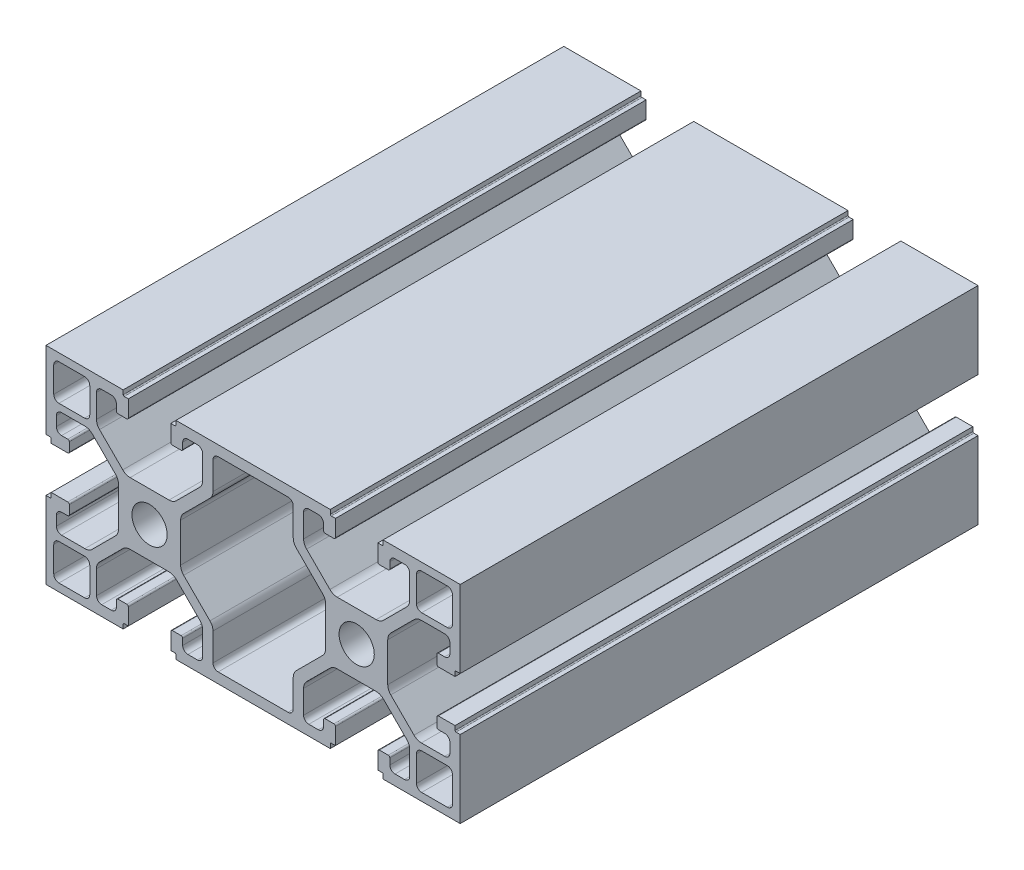
from build123d import *

# Parameters (mm, degrees)
SKETCH_1_R      = 3.4
EXTRUDE_1_DEPTH = 100


with BuildPart() as part:
    # 草图1 → 凸台-拉伸1 (new body)
    with BuildSketch(Plane.XY):
        with BuildLine():
            Line((-24.371587854, 18.940182328), (-39.271587854, 18.940182328))
            Line((-39.271587854, 18.940182328), (-39.271587854, 4.040182328))
            Line((-39.271587854, 4.040182328), (-38.471587854, 4.040182328))
            ThreePointArc((-38.471587854, 4.040182328), (-38.330166498, 3.981603684), (-38.271587854, 3.840182328))
            Line((-38.271587854, 3.840182328), (-38.271587854, 3.040182328))
            Line((-38.271587854, 3.040182328), (-35.071587854, 3.040182328))
            ThreePointArc((-35.071587854, 3.040182328), (-34.85945582, 3.128050294), (-34.771587854, 3.340182328))
            Line((-34.771587854, 3.340182328), (-34.771587854, 5.040182328))
            ThreePointArc((-34.771587854, 5.040182328), (-34.85945582, 5.252314363), (-35.071587854, 5.340182328))
            Line((-35.071587854, 5.340182328), (-36.271587854, 5.340182328))
            ThreePointArc((-36.271587854, 5.340182328), (-36.978694635, 5.633075547), (-37.271587854, 6.340182328))
            Line((-37.271587854, 6.340182328), (-37.271587854, 8.190182328))
            ThreePointArc((-37.271587854, 8.190182328), (-36.978694635, 8.897289109), (-36.271587854, 9.190182328))
            Line((-36.271587854, 9.190182328), (-31.764228541, 9.190182328))
            ThreePointArc((-31.764228541, 9.190182328), (-30.998861677, 9.037941393), (-30.350014979, 8.604395891))
            Line((-30.350014979, 8.604395891), (-25.857374292, 4.111755203))
            ThreePointArc((-25.857374292, 4.111755203), (-25.423828789, 3.462908506), (-25.271587854, 2.697541641))
            Line((-25.271587854, 2.697541641), (-25.271587854, -4.817176985))
            ThreePointArc((-25.271587854, -4.817176985), (-25.423828789, -5.582543849), (-25.857374292, -6.231390547))
            Line((-25.857374292, -6.231390547), (-30.350014979, -10.724031234))
            ThreePointArc((-30.350014979, -10.724031234), (-30.998861677, -11.157576737), (-31.764228541, -11.309817672))
            Line((-31.764228541, -11.309817672), (-36.271587854, -11.309817672))
            ThreePointArc((-36.271587854, -11.309817672), (-36.978694635, -11.016924453), (-37.271587854, -10.309817672))
            Line((-37.271587854, -10.309817672), (-37.271587854, -8.459817672))
            ThreePointArc((-37.271587854, -8.459817672), (-36.978694635, -7.752710891), (-36.271587854, -7.459817672))
            Line((-36.271587854, -7.459817672), (-35.071587854, -7.459817672))
            ThreePointArc((-35.071587854, -7.459817672), (-34.85945582, -7.371949706), (-34.771587854, -7.159817672))
            Line((-34.771587854, -7.159817672), (-34.771587854, -5.459817672))
            ThreePointArc((-34.771587854, -5.459817672), (-34.85945582, -5.247685637), (-35.071587854, -5.159817672))
            Line((-35.071587854, -5.159817672), (-38.271587854, -5.159817672))
            Line((-38.271587854, -5.159817672), (-38.271587854, -5.959817672))
            ThreePointArc((-38.271587854, -5.959817672), (-38.330166498, -6.101239028), (-38.471587854, -6.159817672))
            Line((-38.471587854, -6.159817672), (-39.271587854, -6.159817672))
            Line((-39.271587854, -6.159817672), (-39.271587854, -21.059817672))
            Line((-39.271587854, -21.059817672), (-24.371587854, -21.059817672))
            Line((-24.371587854, -21.059817672), (-24.371587854, -20.259817672))
            ThreePointArc((-24.371587854, -20.259817672), (-24.31300921, -20.118396316), (-24.171587854, -20.059817672))
            Line((-24.171587854, -20.059817672), (-23.371587854, -20.059817672))
            Line((-23.371587854, -20.059817672), (-23.371587854, -16.859817672))
            ThreePointArc((-23.371587854, -16.859817672), (-23.45945582, -16.647685637), (-23.671587854, -16.559817672))
            Line((-23.671587854, -16.559817672), (-25.371587854, -16.559817672))
            ThreePointArc((-25.371587854, -16.559817672), (-25.583719889, -16.647685637), (-25.671587854, -16.859817672))
            Line((-25.671587854, -16.859817672), (-25.671587854, -18.059817672))
            ThreePointArc((-25.671587854, -18.059817672), (-25.964481073, -18.766924453), (-26.671587854, -19.059817672))
            Line((-26.671587854, -19.059817672), (-28.521587854, -19.059817672))
            ThreePointArc((-28.521587854, -19.059817672), (-29.228694635, -18.766924453), (-29.521587854, -18.059817672))
            Line((-29.521587854, -18.059817672), (-29.521587854, -13.552458359))
            ThreePointArc((-29.521587854, -13.552458359), (-29.369346919, -12.787091494), (-28.935801417, -12.138244797))
            Line((-28.935801417, -12.138244797), (-24.443160729, -7.645604109))
            ThreePointArc((-24.443160729, -7.645604109), (-23.794314032, -7.212058607), (-23.028947167, -7.059817672))
            Line((-23.028947167, -7.059817672), (-15.514228541, -7.059817672))
            ThreePointArc((-15.514228541, -7.059817672), (-14.748861677, -7.212058607), (-14.100014979, -7.645604109))
            Line((-14.100014979, -7.645604109), (-9.607374292, -12.138244797))
            ThreePointArc((-9.607374292, -12.138244797), (-9.173828789, -12.787091494), (-9.021587854, -13.552458359))
            Line((-9.021587854, -13.552458359), (-9.021587854, -18.059817672))
            ThreePointArc((-9.021587854, -18.059817672), (-9.314481073, -18.766924453), (-10.021587854, -19.059817672))
            Line((-10.021587854, -19.059817672), (-11.871587854, -19.059817672))
            ThreePointArc((-11.871587854, -19.059817672), (-12.578694635, -18.766924453), (-12.871587854, -18.059817672))
            Line((-12.871587854, -18.059817672), (-12.871587854, -16.859817672))
            ThreePointArc((-12.871587854, -16.859817672), (-12.95945582, -16.647685637), (-13.171587854, -16.559817672))
            Line((-13.171587854, -16.559817672), (-14.871587854, -16.559817672))
            ThreePointArc((-14.871587854, -16.559817672), (-15.083719889, -16.647685637), (-15.171587854, -16.859817672))
            Line((-15.171587854, -16.859817672), (-15.171587854, -20.059817672))
            Line((-15.171587854, -20.059817672), (-14.371587854, -20.059817672))
            ThreePointArc((-14.371587854, -20.059817672), (-14.230166498, -20.118396316), (-14.171587854, -20.259817672))
            Line((-14.171587854, -20.259817672), (-14.171587854, -21.059817672))
            Line((-14.171587854, -21.059817672), (0.728412146, -21.059817672))
            Line((0.728412146, -21.059817672), (15.628412146, -21.059817672))
            Line((15.628412146, -21.059817672), (15.628412146, -20.259817672))
            ThreePointArc((15.628412146, -20.259817672), (15.68699079, -20.118396316), (15.828412146, -20.059817672))
            Line((15.828412146, -20.059817672), (16.628412146, -20.059817672))
            Line((16.628412146, -20.059817672), (16.628412146, -16.859817672))
            ThreePointArc((16.628412146, -16.859817672), (16.54054418, -16.647685637), (16.328412146, -16.559817672))
            Line((16.328412146, -16.559817672), (14.628412146, -16.559817672))
            ThreePointArc((14.628412146, -16.559817672), (14.416280111, -16.647685637), (14.328412146, -16.859817672))
            Line((14.328412146, -16.859817672), (14.328412146, -18.059817672))
            ThreePointArc((14.328412146, -18.059817672), (14.035518927, -18.766924453), (13.328412146, -19.059817672))
            Line((13.328412146, -19.059817672), (11.478412146, -19.059817672))
            ThreePointArc((11.478412146, -19.059817672), (10.771305365, -18.766924453), (10.478412146, -18.059817672))
            Line((10.478412146, -18.059817672), (10.478412146, -13.552458359))
            ThreePointArc((10.478412146, -13.552458359), (10.630653081, -12.787091494), (11.064198583, -12.138244797))
            Line((11.064198583, -12.138244797), (15.556839271, -7.645604109))
            ThreePointArc((15.556839271, -7.645604109), (16.205685968, -7.212058607), (16.971052833, -7.059817672))
            Line((16.971052833, -7.059817672), (24.485771459, -7.059817672))
            ThreePointArc((24.485771459, -7.059817672), (25.251138323, -7.212058607), (25.899985021, -7.645604109))
            Line((25.899985021, -7.645604109), (30.392625708, -12.138244797))
            ThreePointArc((30.392625708, -12.138244797), (30.826171211, -12.787091494), (30.978412146, -13.552458359))
            Line((30.978412146, -13.552458359), (30.978412146, -18.059817672))
            ThreePointArc((30.978412146, -18.059817672), (30.685518927, -18.766924453), (29.978412146, -19.059817672))
            Line((29.978412146, -19.059817672), (28.128412146, -19.059817672))
            ThreePointArc((28.128412146, -19.059817672), (27.421305365, -18.766924453), (27.128412146, -18.059817672))
            Line((27.128412146, -18.059817672), (27.128412146, -16.859817672))
            ThreePointArc((27.128412146, -16.859817672), (27.04054418, -16.647685637), (26.828412146, -16.559817672))
            Line((26.828412146, -16.559817672), (25.128412146, -16.559817672))
            ThreePointArc((25.128412146, -16.559817672), (24.916280111, -16.647685637), (24.828412146, -16.859817672))
            Line((24.828412146, -16.859817672), (24.828412146, -20.059817672))
            Line((24.828412146, -20.059817672), (25.628412146, -20.059817672))
            ThreePointArc((25.628412146, -20.059817672), (25.769833502, -20.118396316), (25.828412146, -20.259817672))
            Line((25.828412146, -20.259817672), (25.828412146, -21.059817672))
            Line((25.828412146, -21.059817672), (40.728412146, -21.059817672))
            Line((40.728412146, -21.059817672), (40.728412146, -6.159817672))
            Line((40.728412146, -6.159817672), (39.928412146, -6.159817672))
            ThreePointArc((39.928412146, -6.159817672), (39.78699079, -6.101239028), (39.728412146, -5.959817672))
            Line((39.728412146, -5.959817672), (39.728412146, -5.159817672))
            Line((39.728412146, -5.159817672), (36.528412146, -5.159817672))
            ThreePointArc((36.528412146, -5.159817672), (36.316280111, -5.247685637), (36.228412146, -5.459817672))
            Line((36.228412146, -5.459817672), (36.228412146, -7.159817672))
            ThreePointArc((36.228412146, -7.159817672), (36.316280111, -7.371949706), (36.528412146, -7.459817672))
            Line((36.528412146, -7.459817672), (37.728412146, -7.459817672))
            ThreePointArc((37.728412146, -7.459817672), (38.435518927, -7.752710891), (38.728412146, -8.459817672))
            Line((38.728412146, -8.459817672), (38.728412146, -10.309817672))
            ThreePointArc((38.728412146, -10.309817672), (38.435518927, -11.016924453), (37.728412146, -11.309817672))
            Line((37.728412146, -11.309817672), (33.221052833, -11.309817672))
            ThreePointArc((33.221052833, -11.309817672), (32.455685968, -11.157576737), (31.806839271, -10.724031234))
            Line((31.806839271, -10.724031234), (27.314198583, -6.231390547))
            ThreePointArc((27.314198583, -6.231390547), (26.880653081, -5.582543849), (26.728412146, -4.817176985))
            Line((26.728412146, -4.817176985), (26.728412146, 2.697541641))
            ThreePointArc((26.728412146, 2.697541641), (26.880653081, 3.462908506), (27.314198583, 4.111755203))
            Line((27.314198583, 4.111755203), (31.806839271, 8.604395891))
            ThreePointArc((31.806839271, 8.604395891), (32.455685968, 9.037941393), (33.221052833, 9.190182328))
            Line((33.221052833, 9.190182328), (37.728412146, 9.190182328))
            ThreePointArc((37.728412146, 9.190182328), (38.435518927, 8.897289109), (38.728412146, 8.190182328))
            Line((38.728412146, 8.190182328), (38.728412146, 6.340182328))
            ThreePointArc((38.728412146, 6.340182328), (38.435518927, 5.633075547), (37.728412146, 5.340182328))
            Line((37.728412146, 5.340182328), (36.528412146, 5.340182328))
            ThreePointArc((36.528412146, 5.340182328), (36.316280111, 5.252314363), (36.228412146, 5.040182328))
            Line((36.228412146, 5.040182328), (36.228412146, 3.340182328))
            ThreePointArc((36.228412146, 3.340182328), (36.316280111, 3.128050294), (36.528412146, 3.040182328))
            Line((36.528412146, 3.040182328), (39.728412146, 3.040182328))
            Line((39.728412146, 3.040182328), (39.728412146, 3.840182328))
            ThreePointArc((39.728412146, 3.840182328), (39.78699079, 3.981603684), (39.928412146, 4.040182328))
            Line((39.928412146, 4.040182328), (40.728412146, 4.040182328))
            Line((40.728412146, 4.040182328), (40.728412146, 18.940182328))
            Line((40.728412146, 18.940182328), (25.828412146, 18.940182328))
            Line((25.828412146, 18.940182328), (25.828412146, 18.140182328))
            ThreePointArc((25.828412146, 18.140182328), (25.769833502, 17.998760972), (25.628412146, 17.940182328))
            Line((25.628412146, 17.940182328), (24.828412146, 17.940182328))
            Line((24.828412146, 17.940182328), (24.828412146, 14.740182328))
            ThreePointArc((24.828412146, 14.740182328), (24.916280111, 14.528050294), (25.128412146, 14.440182328))
            Line((25.128412146, 14.440182328), (26.828412146, 14.440182328))
            ThreePointArc((26.828412146, 14.440182328), (27.04054418, 14.528050294), (27.128412146, 14.740182328))
            Line((27.128412146, 14.740182328), (27.128412146, 15.940182328))
            ThreePointArc((27.128412146, 15.940182328), (27.421305365, 16.647289109), (28.128412146, 16.940182328))
            Line((28.128412146, 16.940182328), (29.978412146, 16.940182328))
            ThreePointArc((29.978412146, 16.940182328), (30.685518927, 16.647289109), (30.978412146, 15.940182328))
            Line((30.978412146, 15.940182328), (30.978412146, 11.432823015))
            ThreePointArc((30.978412146, 11.432823015), (30.826171211, 10.667456151), (30.392625708, 10.018609453))
            Line((30.392625708, 10.018609453), (25.899985021, 5.525968766))
            ThreePointArc((25.899985021, 5.525968766), (25.251138323, 5.092423263), (24.485771459, 4.940182328))
            Line((24.485771459, 4.940182328), (16.971052833, 4.940182328))
            ThreePointArc((16.971052833, 4.940182328), (16.205685968, 5.092423263), (15.556839271, 5.525968766))
            Line((15.556839271, 5.525968766), (11.064198583, 10.018609453))
            ThreePointArc((11.064198583, 10.018609453), (10.630653081, 10.667456151), (10.478412146, 11.432823015))
            Line((10.478412146, 11.432823015), (10.478412146, 15.940182328))
            ThreePointArc((10.478412146, 15.940182328), (10.771305365, 16.647289109), (11.478412146, 16.940182328))
            Line((11.478412146, 16.940182328), (13.328412146, 16.940182328))
            ThreePointArc((13.328412146, 16.940182328), (14.035518927, 16.647289109), (14.328412146, 15.940182328))
            Line((14.328412146, 15.940182328), (14.328412146, 14.740182328))
            ThreePointArc((14.328412146, 14.740182328), (14.416280111, 14.528050294), (14.628412146, 14.440182328))
            Line((14.628412146, 14.440182328), (16.328412146, 14.440182328))
            ThreePointArc((16.328412146, 14.440182328), (16.54054418, 14.528050294), (16.628412146, 14.740182328))
            Line((16.628412146, 14.740182328), (16.628412146, 17.940182328))
            Line((16.628412146, 17.940182328), (15.828412146, 17.940182328))
            ThreePointArc((15.828412146, 17.940182328), (15.68699079, 17.998760972), (15.628412146, 18.140182328))
            Line((15.628412146, 18.140182328), (15.628412146, 18.940182328))
            Line((15.628412146, 18.940182328), (0.728412146, 18.940182328))
            Line((0.728412146, 18.940182328), (-14.171587854, 18.940182328))
            Line((-14.171587854, 18.940182328), (-14.171587854, 18.140182328))
            ThreePointArc((-14.171587854, 18.140182328), (-14.230166498, 17.998760972), (-14.371587854, 17.940182328))
            Line((-14.371587854, 17.940182328), (-15.171587854, 17.940182328))
            Line((-15.171587854, 17.940182328), (-15.171587854, 14.740182328))
            ThreePointArc((-15.171587854, 14.740182328), (-15.083719889, 14.528050294), (-14.871587854, 14.440182328))
            Line((-14.871587854, 14.440182328), (-13.171587854, 14.440182328))
            ThreePointArc((-13.171587854, 14.440182328), (-12.95945582, 14.528050294), (-12.871587854, 14.740182328))
            Line((-12.871587854, 14.740182328), (-12.871587854, 15.940182328))
            ThreePointArc((-12.871587854, 15.940182328), (-12.578694635, 16.647289109), (-11.871587854, 16.940182328))
            Line((-11.871587854, 16.940182328), (-10.021587854, 16.940182328))
            ThreePointArc((-10.021587854, 16.940182328), (-9.314481073, 16.647289109), (-9.021587854, 15.940182328))
            Line((-9.021587854, 15.940182328), (-9.021587854, 11.432823015))
            ThreePointArc((-9.021587854, 11.432823015), (-9.173828789, 10.667456151), (-9.607374292, 10.018609453))
            Line((-9.607374292, 10.018609453), (-14.100014979, 5.525968766))
            ThreePointArc((-14.100014979, 5.525968766), (-14.748861677, 5.092423263), (-15.514228541, 4.940182328))
            Line((-15.514228541, 4.940182328), (-23.028947167, 4.940182328))
            ThreePointArc((-23.028947167, 4.940182328), (-23.794314032, 5.092423263), (-24.443160729, 5.525968766))
            Line((-24.443160729, 5.525968766), (-28.935801417, 10.018609453))
            ThreePointArc((-28.935801417, 10.018609453), (-29.369346919, 10.667456151), (-29.521587854, 11.432823015))
            Line((-29.521587854, 11.432823015), (-29.521587854, 15.940182328))
            ThreePointArc((-29.521587854, 15.940182328), (-29.228694635, 16.647289109), (-28.521587854, 16.940182328))
            Line((-28.521587854, 16.940182328), (-26.671587854, 16.940182328))
            ThreePointArc((-26.671587854, 16.940182328), (-25.964481073, 16.647289109), (-25.671587854, 15.940182328))
            Line((-25.671587854, 15.940182328), (-25.671587854, 14.740182328))
            ThreePointArc((-25.671587854, 14.740182328), (-25.583719889, 14.528050294), (-25.371587854, 14.440182328))
            Line((-25.371587854, 14.440182328), (-23.671587854, 14.440182328))
            ThreePointArc((-23.671587854, 14.440182328), (-23.45945582, 14.528050294), (-23.371587854, 14.740182328))
            Line((-23.371587854, 14.740182328), (-23.371587854, 17.940182328))
            Line((-23.371587854, 17.940182328), (-24.171587854, 17.940182328))
            ThreePointArc((-24.171587854, 17.940182328), (-24.31300921, 17.998760972), (-24.371587854, 18.140182328))
            Line((-24.371587854, 18.140182328), (-24.371587854, 18.940182328))
        make_face()
        with Locations((-19.271587854, -1.059817672)):
            Circle(SKETCH_1_R, mode=Mode.SUBTRACT)
        with Locations((20.728412146, -1.059817672)):
            Circle(SKETCH_1_R, mode=Mode.SUBTRACT)
        with BuildLine():
            Line((-13.271587854, 2.697541641), (-13.271587854, -4.817176985))
            ThreePointArc((-13.271587854, -4.817176985), (-13.119346919, -5.582543849), (-12.685801417, -6.231390547))
            Line((-12.685801417, -6.231390547), (-7.607374292, -11.309817672))
            ThreePointArc((-7.607374292, -11.309817672), (-7.173828789, -11.958664369), (-7.021587854, -12.724031234))
            Line((-7.021587854, -12.724031234), (-7.021587854, -18.059817672))
            ThreePointArc((-7.021587854, -18.059817672), (-6.728694635, -18.766924453), (-6.021587854, -19.059817672))
            Line((-6.021587854, -19.059817672), (7.478412146, -19.059817672))
            ThreePointArc((7.478412146, -19.059817672), (8.185518927, -18.766924453), (8.478412146, -18.059817672))
            Line((8.478412146, -18.059817672), (8.478412146, -12.724031234))
            ThreePointArc((8.478412146, -12.724031234), (8.630653081, -11.958664369), (9.064198583, -11.309817672))
            Line((9.064198583, -11.309817672), (14.142625708, -6.231390547))
            ThreePointArc((14.142625708, -6.231390547), (14.576171211, -5.582543849), (14.728412146, -4.817176985))
            Line((14.728412146, -4.817176985), (14.728412146, 2.697541641))
            ThreePointArc((14.728412146, 2.697541641), (14.576171211, 3.462908506), (14.142625708, 4.111755203))
            Line((14.142625708, 4.111755203), (9.064198583, 9.190182328))
            ThreePointArc((9.064198583, 9.190182328), (8.630653081, 9.839029026), (8.478412146, 10.604395891))
            Line((8.478412146, 10.604395891), (8.478412146, 15.940182328))
            ThreePointArc((8.478412146, 15.940182328), (8.185518927, 16.647289109), (7.478412146, 16.940182328))
            Line((7.478412146, 16.940182328), (-6.021587854, 16.940182328))
            ThreePointArc((-6.021587854, 16.940182328), (-6.728694635, 16.647289109), (-7.021587854, 15.940182328))
            Line((-7.021587854, 15.940182328), (-7.021587854, 10.604395891))
            ThreePointArc((-7.021587854, 10.604395891), (-7.173828789, 9.839029026), (-7.607374292, 9.190182328))
            Line((-7.607374292, 9.190182328), (-12.685801417, 4.111755203))
            ThreePointArc((-12.685801417, 4.111755203), (-13.119346919, 3.462908506), (-13.271587854, 2.697541641))
        make_face(mode=Mode.SUBTRACT)
        with BuildLine():
            Line((38.232412146, 17.444182328), (33.278412146, 17.444182328))
            ThreePointArc((33.278412146, 17.444182328), (32.571305365, 17.151289109), (32.278412146, 16.444182328))
            Line((32.278412146, 16.444182328), (32.278412146, 11.490182328))
            ThreePointArc((32.278412146, 11.490182328), (32.571305365, 10.783075547), (33.278412146, 10.490182328))
            Line((33.278412146, 10.490182328), (38.232412146, 10.490182328))
            ThreePointArc((38.232412146, 10.490182328), (38.939518927, 10.783075547), (39.232412146, 11.490182328))
            Line((39.232412146, 11.490182328), (39.232412146, 16.444182328))
            ThreePointArc((39.232412146, 16.444182328), (38.939518927, 17.151289109), (38.232412146, 17.444182328))
        make_face(mode=Mode.SUBTRACT)
        with BuildLine():
            Line((-36.775587854, 10.490182328), (-31.821587854, 10.490182328))
            ThreePointArc((-31.821587854, 10.490182328), (-31.114481073, 10.783075547), (-30.821587854, 11.490182328))
            Line((-30.821587854, 11.490182328), (-30.821587854, 16.444182328))
            ThreePointArc((-30.821587854, 16.444182328), (-31.114481073, 17.151289109), (-31.821587854, 17.444182328))
            Line((-31.821587854, 17.444182328), (-36.775587854, 17.444182328))
            ThreePointArc((-36.775587854, 17.444182328), (-37.482694635, 17.151289109), (-37.775587854, 16.444182328))
            Line((-37.775587854, 16.444182328), (-37.775587854, 11.490182328))
            ThreePointArc((-37.775587854, 11.490182328), (-37.482694635, 10.783075547), (-36.775587854, 10.490182328))
        make_face(mode=Mode.SUBTRACT)
        with BuildLine():
            Line((38.232412146, -19.563817672), (33.278412146, -19.563817672))
            ThreePointArc((33.278412146, -19.563817672), (32.571305365, -19.270924453), (32.278412146, -18.563817672))
            Line((32.278412146, -18.563817672), (32.278412146, -13.609817672))
            ThreePointArc((32.278412146, -13.609817672), (32.571305365, -12.902710891), (33.278412146, -12.609817672))
            Line((33.278412146, -12.609817672), (38.232412146, -12.609817672))
            ThreePointArc((38.232412146, -12.609817672), (38.939518927, -12.902710891), (39.232412146, -13.609817672))
            Line((39.232412146, -13.609817672), (39.232412146, -18.563817672))
            ThreePointArc((39.232412146, -18.563817672), (38.939518927, -19.270924453), (38.232412146, -19.563817672))
        make_face(mode=Mode.SUBTRACT)
        with BuildLine():
            Line((-31.821587854, -19.563817672), (-36.775587854, -19.563817672))
            ThreePointArc((-36.775587854, -19.563817672), (-37.482694635, -19.270924453), (-37.775587854, -18.563817672))
            Line((-37.775587854, -18.563817672), (-37.775587854, -13.609817672))
            ThreePointArc((-37.775587854, -13.609817672), (-37.482694635, -12.902710891), (-36.775587854, -12.609817672))
            Line((-36.775587854, -12.609817672), (-31.821587854, -12.609817672))
            ThreePointArc((-31.821587854, -12.609817672), (-31.114481073, -12.902710891), (-30.821587854, -13.609817672))
            Line((-30.821587854, -13.609817672), (-30.821587854, -18.563817672))
            ThreePointArc((-30.821587854, -18.563817672), (-31.114481073, -19.270924453), (-31.821587854, -19.563817672))
        make_face(mode=Mode.SUBTRACT)
    extrude(amount=EXTRUDE_1_DEPTH)


solid = part.part
